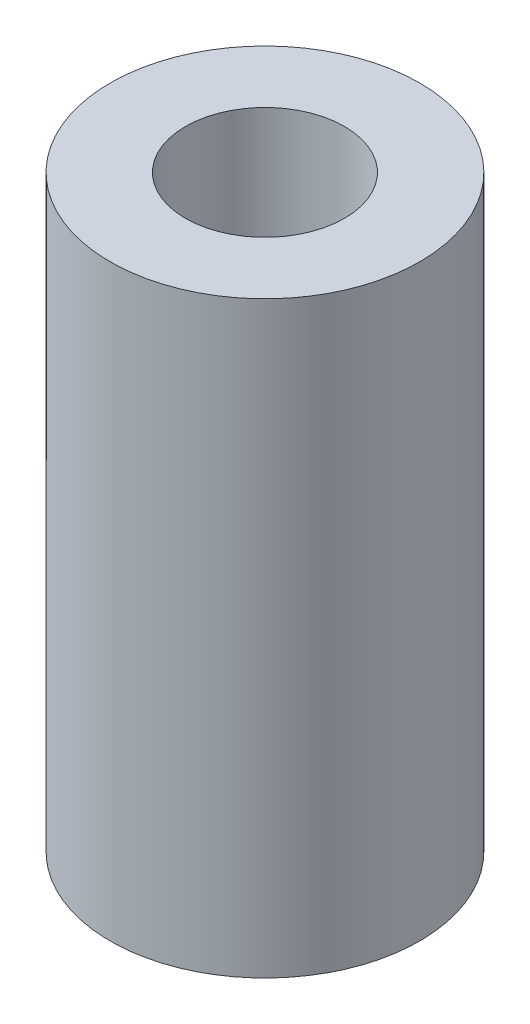
from build123d import *

# Parameters (mm, degrees)
SKETCH1_R           = 6.35
SKETCH1_R_2         = 3.2639
BOSS_EXTRUDE1_DEPTH = 24.13


with BuildPart() as part:
    # Sketch1 → Boss-Extrude1 (new body)
    with BuildSketch(Plane(origin=(0, 0, 0), x_dir=(1, 0, 0), z_dir=(0, 1, 0))):
        with Locations(Location((0, 0, 0), (0, 0, 90))):
            Circle(SKETCH1_R)
        with Locations(Location((0, 0, 0), (0, 0, 90))):
            Circle(SKETCH1_R_2, mode=Mode.SUBTRACT)
    extrude(amount=BOSS_EXTRUDE1_DEPTH)


solid = part.part
